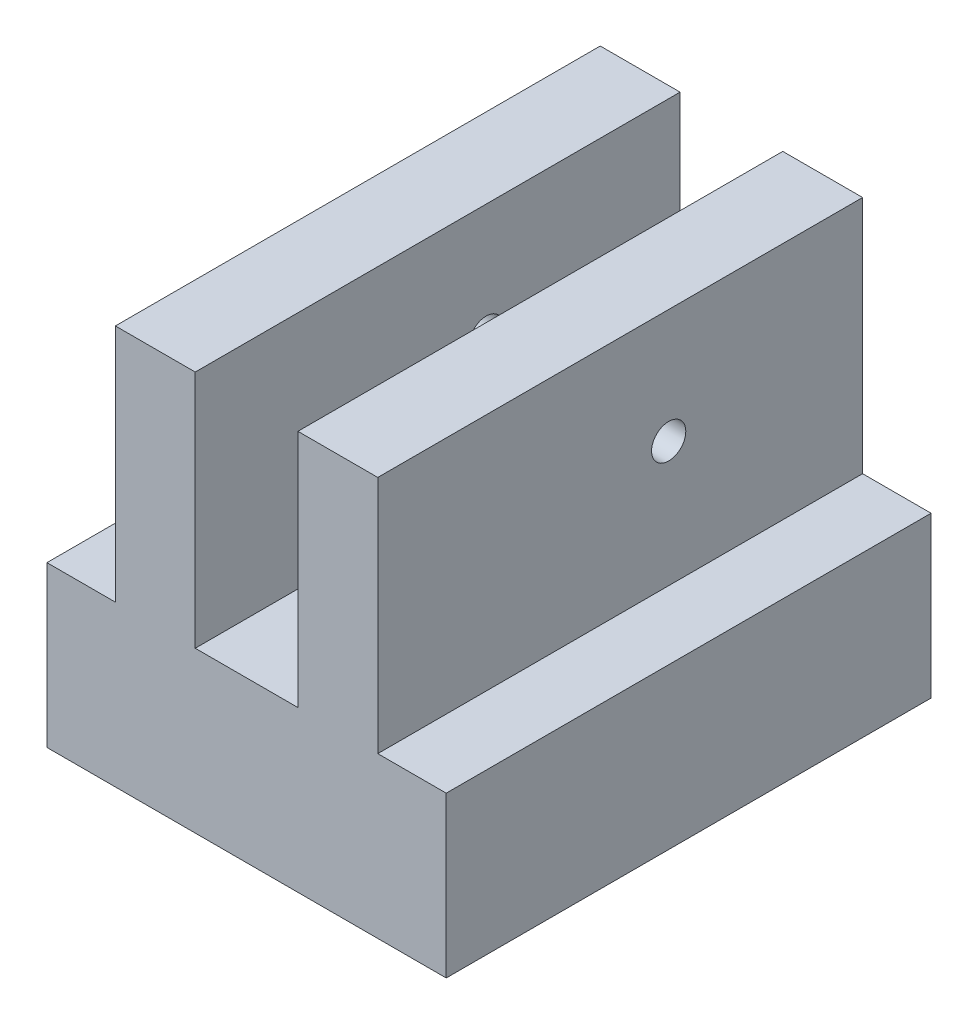
from build123d import *

# Parameters (mm, degrees)
SKETCH1_W           = 70
SKETCH1_H           = 85
BOSS_EXTRUDE1_DEPTH = 70
SKETCH2_R           = 5
CUT_EXTRUDE1_DEPTH  = 20
SKETCH3_W           = 24.749109438
SKETCH3_H           = 45.30683744
CUT_EXTRUDE2_DEPTH  = 116.542200083
SKETCH4_R           = 3
CUT_EXTRUDE3_DEPTH  = 101.350635275
SKETCH6_W           = 18
SKETCH6_H           = 62.779044911
CUT_EXTRUDE4_DEPTH  = 116.542200083


with BuildPart() as part:
    # Sketch1 → Boss-Extrude1 (new body)
    with BuildSketch(Plane(origin=(0, 0, 0), x_dir=(1, 0, 0), z_dir=(0, 1, 0))):
        Rectangle(SKETCH1_W, SKETCH1_H)
    extrude(amount=BOSS_EXTRUDE1_DEPTH)

    # Sketch2 → Cut-Extrude1 (cut)
    with BuildSketch(Plane.XZ):
        with Locations(Location((0, 0, 0), (0, 0, 270))):
            Circle(SKETCH2_R)
    extrude(amount=-CUT_EXTRUDE1_DEPTH, mode=Mode.SUBTRACT)

    # Sketch3 → Cut-Extrude2 (cut, through all)
    with BuildSketch(Plane(origin=(0, 0, -42.5), x_dir=(-1, 0, 0), z_dir=(0, 0, -1))):
        with Locations((-35.374554719, 50.717680389)):
            Rectangle(SKETCH3_W, SKETCH3_H)
        with Locations((35.374554719, 50.717680389)):
            Rectangle(SKETCH3_W, SKETCH3_H)
    extrude(amount=-CUT_EXTRUDE2_DEPTH, mode=Mode.SUBTRACT)

    # Sketch4 → Cut-Extrude3 (cut, through all)
    with BuildSketch(Plane.ZY.offset(23)):
        with Locations(Location((-8.5, 50, 0), (0, 0, 270))):
            Circle(SKETCH4_R)
    extrude(amount=-CUT_EXTRUDE3_DEPTH, mode=Mode.SUBTRACT)

    # Sketch6 → Cut-Extrude4 (cut, through all)
    with BuildSketch(Plane(origin=(0, 0, -42.5), x_dir=(-1, 0, 0), z_dir=(0, 0, -1))):
        with Locations((0, 59.453784125)):
            Rectangle(SKETCH6_W, SKETCH6_H)
    extrude(amount=-CUT_EXTRUDE4_DEPTH, mode=Mode.SUBTRACT)


solid = part.part
